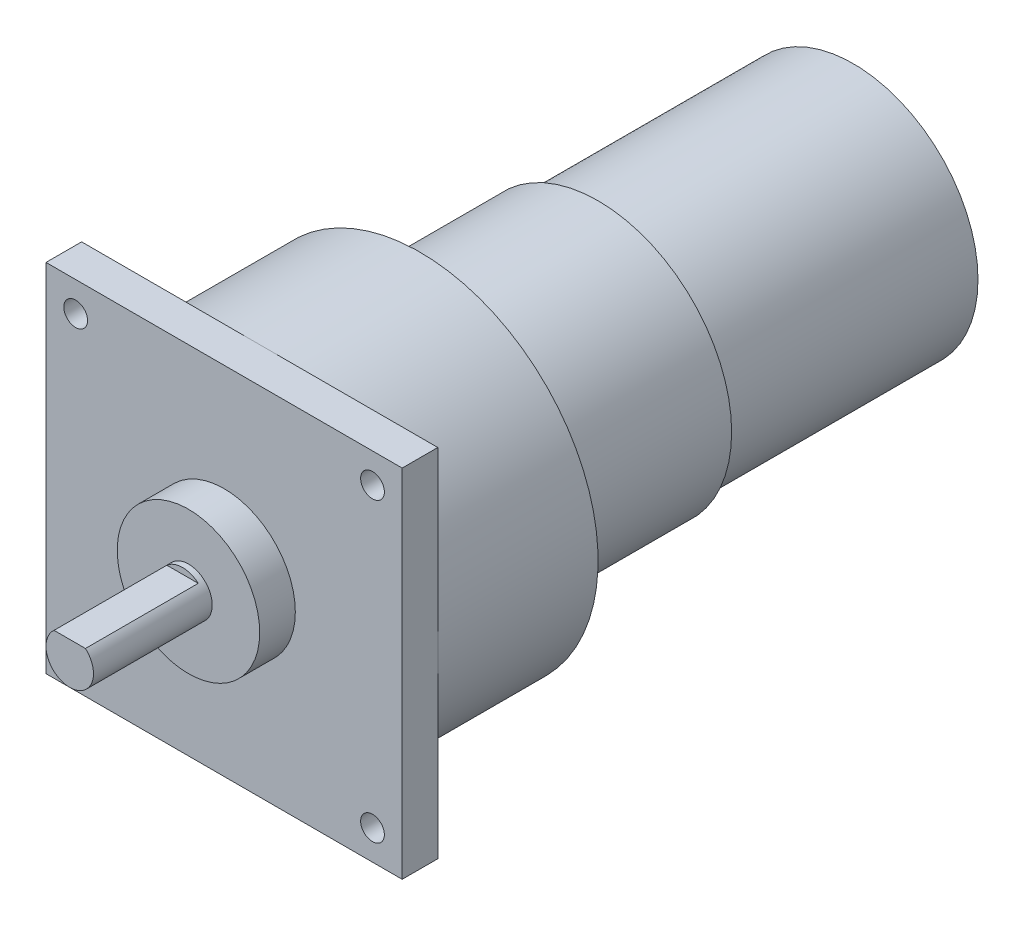
from build123d import *

# Parameters (mm, degrees)
SKETCH1_W           = 60
SKETCH1_H           = 60
SKETCH1_R           = 2
BOSS_EXTRUDE1_DEPTH = 6
SKETCH2_R           = 12
BOSS_EXTRUDE2_DEPTH = 6
SKETCH3_R           = 4
BOSS_EXTRUDE3_DEPTH = 20
CUT_EXTRUDE1_START  = -19
CUT_EXTRUDE1_DEPTH  = 19
SKETCH5_R           = 30
BOSS_EXTRUDE4_DEPTH = 27
SKETCH6_R           = 22.5
BOSS_EXTRUDE5_DEPTH = 30
SKETCH7_R           = 21
BOSS_EXTRUDE6_DEPTH = 43


with BuildPart() as part:
    # Sketch1 → Boss-Extrude1 (new body)
    with BuildSketch(Plane.XY):
        Rectangle(SKETCH1_W, SKETCH1_H)
        with Locations((-25, 25)):
            Circle(SKETCH1_R, mode=Mode.SUBTRACT)
        with Locations((25, 25)):
            Circle(SKETCH1_R, mode=Mode.SUBTRACT)
        with Locations((-25, -25)):
            Circle(SKETCH1_R, mode=Mode.SUBTRACT)
        with Locations((25, -25)):
            Circle(SKETCH1_R, mode=Mode.SUBTRACT)
    extrude(amount=BOSS_EXTRUDE1_DEPTH)

    # Sketch2 → Boss-Extrude2 (add)
    with BuildSketch(Plane.XY.offset(6)):
        Circle(SKETCH2_R)
    extrude(amount=BOSS_EXTRUDE2_DEPTH)

    # Sketch3 → Boss-Extrude3 (add)
    with BuildSketch(Plane.XY.offset(12)):
        Circle(SKETCH3_R)
    extrude(amount=BOSS_EXTRUDE3_DEPTH)

    # Sketch4 → Cut-Extrude1 (cut)
    with BuildSketch(Plane.XY.offset(32).offset(CUT_EXTRUDE1_START)):
        with BuildLine():
            Line((-2.645751311, 3), (2.645751311, 3))
            ThreePointArc((2.645751311, 3), (0, 4), (-2.645751311, 3))
        make_face()
    extrude(amount=CUT_EXTRUDE1_DEPTH, mode=Mode.SUBTRACT)

    # Sketch5 → Boss-Extrude4 (add)
    with BuildSketch(Plane(origin=(0, 0, 0), x_dir=(-1, 0, 0), z_dir=(0, 0, -1))):
        Circle(SKETCH5_R)
    extrude(amount=BOSS_EXTRUDE4_DEPTH)

    # Sketch6 → Boss-Extrude5 (add)
    with BuildSketch(Plane(origin=(0, 0, -27), x_dir=(-1, 0, 0), z_dir=(0, 0, -1))):
        Circle(SKETCH6_R)
    extrude(amount=BOSS_EXTRUDE5_DEPTH)

    # Sketch7 → Boss-Extrude6 (add)
    with BuildSketch(Plane(origin=(0, 0, -57), x_dir=(-1, 0, 0), z_dir=(0, 0, -1))):
        Circle(SKETCH7_R)
    extrude(amount=BOSS_EXTRUDE6_DEPTH)


solid = part.part
